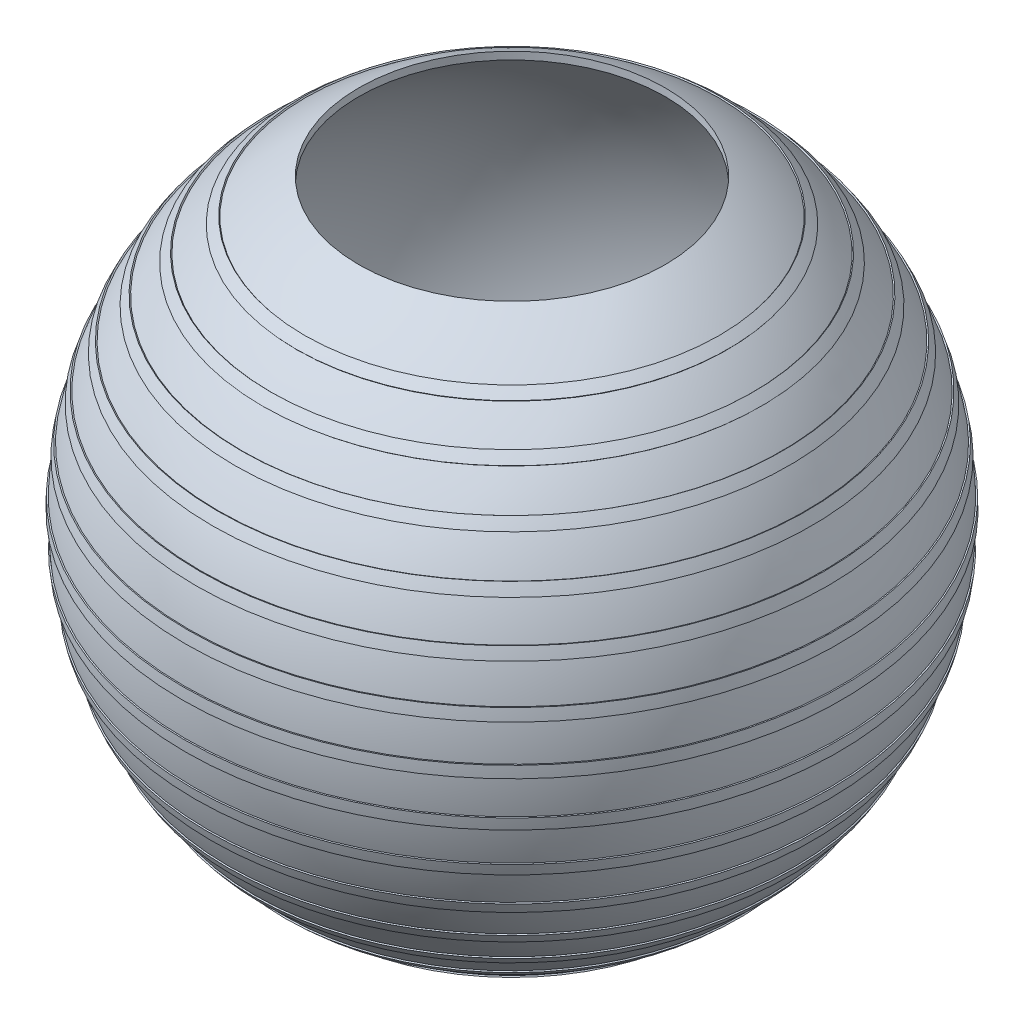
from build123d import *


with BuildPart() as part:
    # Croquis1 → Revolución1 (revolve)
    with BuildSketch(Plane(origin=(0, 0, 0), x_dir=(0, 0, -1), z_dir=(1, 0, 0))):
        with BuildLine():
            Line((-0.5, 24.494897428), (-0.5, 23.994791101))
            ThreePointArc((-0.5, 23.994791101), (-23.99869774, -0.250013566), (0, -24))
            Line((0, -24), (0, -24.5))
            ThreePointArc((0, -24.5), (-24.498724324, -0.250013018), (-0.5, 24.494897428))
        make_face()
    revolve(axis=Axis((0, 20.75, 0), (0, -1, 0)))

    # Croquis2 → Cortar-Revolución1 (revolve, cut)
    with BuildSketch(Plane(origin=(0, 0, 0), x_dir=(0, 0, -1), z_dir=(1, 0, 0))):
        with BuildLine():
            Line((0, 13.612081927), (0, 24.5))
            ThreePointArc((0, 24.5), (5.891594158, 23.781066382), (11.437419735, 21.666458635))
            Line((11.437419735, 21.666458635), (11.437419735, 13.612081927))
            Line((11.437419735, 13.612081927), (0, 13.612081927))
        make_face()
    revolve(axis=Axis((0, 0, 0), (0, 1, 0)), mode=Mode.SUBTRACT)

    # Croquis3 → Revolución2 (revolve)
    with BuildSketch(Plane(origin=(0, 0, 0), x_dir=(0, 0, -1), z_dir=(1, 0, 0))):
        with BuildLine():
            Line((-15.418349581, 19.040076056), (-15.48128162, 19.117790652))
            ThreePointArc((-15.48128162, 19.117790652), (-15.812575198, 18.844693301), (-16.139052113, 18.565855673))
            Line((-16.139052113, 18.565855673), (-16.07344621, 18.490384715))
            ThreePointArc((-16.07344621, 18.490384715), (-15.748296437, 18.768088856), (-15.418349581, 19.040076056))
        make_face()
        with BuildLine():
            Line((-17.954576314, 16.669828715), (-18.027860299, 16.737868832))
            ThreePointArc((-18.027860299, 16.737868832), (-18.317230658, 16.420690028), (-18.601021412, 16.098509323))
            Line((-18.601021412, 16.098509323), (-18.525407504, 16.033068229))
            ThreePointArc((-18.525407504, 16.033068229), (-18.242770371, 16.353939256), (-17.954576314, 16.669828715))
        make_face()
        with BuildLine():
            Line((-20.13034998, 13.964920684), (-20.212514673, 14.02192036))
            ThreePointArc((-20.212514673, 14.02192036), (-20.454152463, 13.667027732), (-20.689559719, 13.307971996))
            Line((-20.689559719, 13.307971996), (-20.605455818, 13.253874549))
            ThreePointArc((-20.605455818, 13.253874549), (-20.371005501, 13.611470709), (-20.13034998, 13.964920684))
        make_face()
        with BuildLine():
            Line((-21.901990109, 10.979655243), (-21.991385987, 11.024470162))
            ThreePointArc((-21.991385987, 11.024470162), (-22.180440127, 10.638988476), (-22.362737889, 10.25026605))
            Line((-22.362737889, 10.25026605), (-22.271832451, 10.208598302))
            ThreePointArc((-22.271832451, 10.208598302), (-22.090275736, 10.595740555), (-21.901990109, 10.979655243))
        make_face()
        with BuildLine():
            Line((-23.233929553, 7.773964082), (-23.328761918, 7.805694548))
            ThreePointArc((-23.328761918, 7.805694548), (-23.461436988, 7.397362668), (-23.586965478, 6.98677748))
            Line((-23.586965478, 6.98677748), (-23.491083504, 6.958375945))
            ThreePointArc((-23.491083504, 6.958375945), (-23.366065293, 7.367292088), (-23.233929553, 7.773964082))
        make_face()
        with BuildLine():
            Line((-24.099428516, 4.41220412), (-24.197793531, 4.430213116))
            ThreePointArc((-24.197793531, 4.430213116), (-24.271425969, 4.007228646), (-24.337665097, 3.583023534))
            Line((-24.337665097, 3.583023534), (-24.238731499, 3.568458398))
            ThreePointArc((-24.238731499, 3.568458398), (-24.172761636, 3.990939098), (-24.099428516, 4.41220412))
        make_face()
        with BuildLine():
            Line((-24.481111388, 0.961865486), (-24.581034292, 0.965791468))
            ThreePointArc((-24.581034292, 0.965791468), (-24.594145866, 0.536646172), (-24.599765826, 0.107337408))
            Line((-24.599765826, 0.107337408), (-24.499766778, 0.106901078))
            ThreePointArc((-24.499766778, 0.106901078), (-24.494169663, 0.534464683), (-24.481111388, 0.961865486))
        make_face()
        with BuildLine():
            Line((-24.371315566, -2.507783398), (-24.470790324, -2.518019248))
            ThreePointArc((-24.470790324, -2.518019248), (-24.423117808, -2.94470992), (-24.368005775, -3.370503605))
            Line((-24.368005775, -3.370503605), (-24.268948841, -3.356802371))
            ThreePointArc((-24.268948841, -3.356802371), (-24.323836842, -2.932739555), (-24.371315566, -2.507783398))
        make_face()
        with BuildLine():
            Line((-23.772245294, -5.927086442), (-23.869274866, -5.951278632))
            ThreePointArc((-23.869274866, -5.951278632), (-23.761775327, -6.36694851), (-23.64703772, -6.780678953))
            Line((-23.64703772, -6.780678953), (-23.55091155, -6.753115217))
            ThreePointArc((-23.55091155, -6.753115217), (-23.665182744, -6.341066605), (-23.772245294, -5.927086442))
        make_face()
        with BuildLine():
            Line((-22.695927405, -9.227398291), (-22.788563843, -9.265061142))
            ThreePointArc((-22.788563843, -9.265061142), (-22.623395422, -9.661365306), (-22.451335695, -10.054726525))
            Line((-22.451335695, -10.054726525), (-22.360070103, -10.013853653))
            ThreePointArc((-22.360070103, -10.013853653), (-22.5314304, -9.622091464), (-22.695927405, -9.227398291))
        make_face()
        with BuildLine():
            Line((-21.163969878, -12.342462438), (-21.250353428, -12.392839835))
            ThreePointArc((-21.250353428, -12.392839835), (-21.030832019, -12.761822151), (-20.804904414, -13.126917091))
            Line((-20.804904414, -13.126917091), (-20.720331632, -13.07355564))
            ThreePointArc((-20.720331632, -13.07355564), (-20.945340831, -12.709944825), (-21.163969878, -12.342462438))
        make_face()
        with BuildLine():
            Line((-19.207128034, -15.209741374), (-19.285524475, -15.271821951))
            ThreePointArc((-19.285524475, -15.271821951), (-19.016057153, -15.60607479), (-18.740797355, -15.935573868))
            Line((-18.740797355, -15.935573868), (-18.664615252, -15.870795112))
            ThreePointArc((-18.664615252, -15.870795112), (-18.938756107, -15.542635462), (-19.207128034, -15.209741374))
        make_face()
        with BuildLine():
            Line((-16.864687104, -17.77167209), (-16.933522562, -17.844209527))
            ThreePointArc((-16.933522562, -17.844209527), (-16.619519107, -18.137022486), (-16.300453186, -18.424310731))
            Line((-16.300453186, -18.424310731), (-16.234191181, -18.349415159))
            ThreePointArc((-16.234191181, -18.349415159), (-16.551960087, -18.063294752), (-16.864687104, -17.77167209))
        make_face()
        with BuildLine():
            Line((-14.18367354, -19.976821692), (-14.241566085, -20.05835974))
            ThreePointArc((-14.241566085, -20.05835974), (-13.889330379, -20.303854354), (-13.532863848, -20.543164217))
            Line((-13.532863848, -20.543164217), (-13.477852207, -20.45965542))
            ThreePointArc((-13.477852207, -20.45965542), (-13.832869686, -20.221318361), (-14.18367354, -19.976821692))
        make_face()
        with BuildLine():
            Line((-11.21791092, -21.780919966), (-11.263698312, -21.869821681))
            ThreePointArc((-11.263698312, -21.869821681), (-10.880301779, -22.063069442), (-10.493591002, -22.249596578))
            Line((-10.493591002, -22.249596578), (-10.450934128, -22.159151064))
            ThreePointArc((-10.450934128, -22.159151064), (-10.83607291, -21.973382168), (-11.21791092, -21.780919966))
        make_face()
        with BuildLine():
            Line((-8.026939399, -23.147748138), (-8.059702417, -23.242228743))
            ThreePointArc((-8.059702417, -23.242228743), (-7.652842063, -23.379350041), (-7.243650579, -23.509349763))
            Line((-7.243650579, -23.509349763), (-7.214204845, -23.413783301))
            ThreePointArc((-7.214204845, -23.413783301), (-7.621732949, -23.284312033), (-8.026939399, -23.147748138))
        make_face()
        with BuildLine():
            Line((-4.674820387, -24.049865994), (-4.693901286, -24.148028713))
            ThreePointArc((-4.693901286, -24.148028713), (-4.271745171, -24.226270724), (-3.84828784, -24.297133179))
            Line((-3.84828784, -24.297133179), (-3.832644394, -24.198364345))
            ThreePointArc((-3.832644394, -24.198364345), (-4.254380353, -24.127789949), (-4.674820387, -24.049865994))
        make_face()
    revolve(axis=Axis((0, 0, 0), (0, 1, 0)))


solid = part.part
